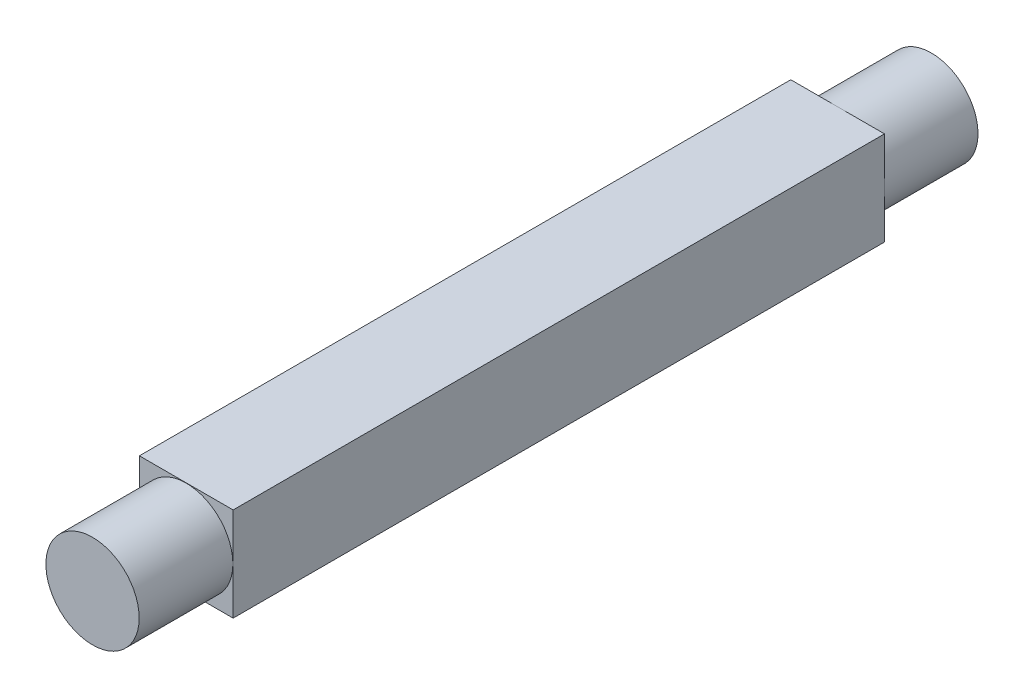
from build123d import *

# Parameters (mm, degrees)
SKETCH1_W           = 4
SKETCH1_H           = 4
BOSS_EXTRUDE1_DEPTH = 13.9
SKETCH2_R           = 1.99
BOSS_EXTRUDE2_DEPTH = 4


with BuildPart() as part:
    # Sketch1 → Boss-Extrude1 (new, symmetric)
    with BuildSketch(Plane.XY):
        Rectangle(SKETCH1_W, SKETCH1_H)
    extrude(amount=BOSS_EXTRUDE1_DEPTH, both=True)

    # Sketch2 → Boss-Extrude2 (add)
    with BuildSketch(Plane.XY.offset(13.9)):
        Circle(SKETCH2_R)
    boss_extrude2 = extrude(amount=BOSS_EXTRUDE2_DEPTH)

    # Mirror2: Boss-Extrude2 across plane
    add(boss_extrude2.mirror(Plane.XY))


solid = part.part
